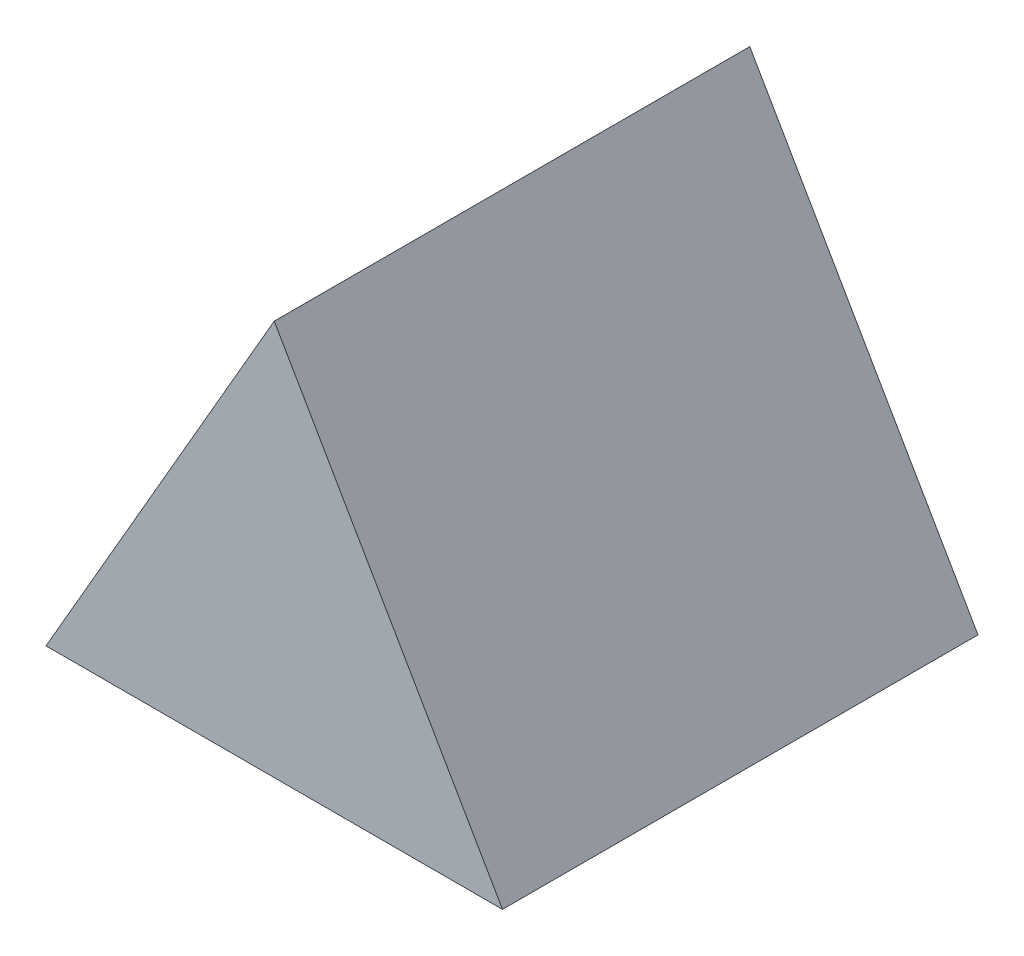
from build123d import *

# Parameters (mm, degrees)
SALIENTE_EXTRUIR2_DEPTH = 50
CROQUIS3_R              = 2.482100889
CORTAR_EXTRUIR1_DEPTH   = 10


with BuildPart() as part:
    # Croquis1 → Saliente-Extruir2 (new body)
    with BuildSketch(Plane.XY):
        Polygon((0.204464985, 41.569219382), (-23.795535015, 0), (24.204464985, 0), align=None)
    extrude(amount=SALIENTE_EXTRUIR2_DEPTH)

    # Croquis3 → Cortar-Extruir1 (cut)
    with BuildSketch(Plane(origin=(0, 0, 0), x_dir=(-1, 0, 0), z_dir=(0, 0, -1))):
        with Locations((0, 14.238722588)):
            Circle(CROQUIS3_R)
    extrude(amount=-CORTAR_EXTRUIR1_DEPTH, mode=Mode.SUBTRACT)


solid = part.part
